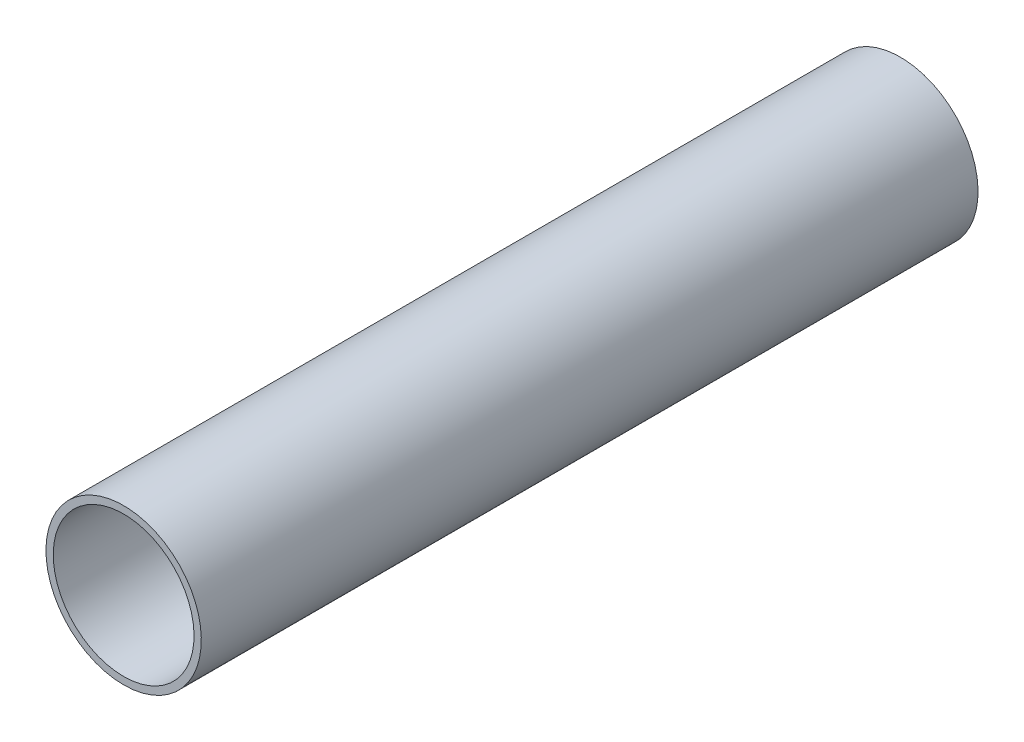
from build123d import *

# Parameters (mm, degrees)
SKETCH1_W = 80
SKETCH1_H = 0.75


with BuildPart() as part:
    # Sketch1 → Revolve1 (revolve)
    with BuildSketch(Plane(origin=(0, 0, 0), x_dir=(0, 0, -1), z_dir=(1, 0, 0)), mode=Mode.PRIVATE) as revolve1_sk:
        with Locations((0, 7.625)):
            Rectangle(SKETCH1_W, SKETCH1_H)
    revolve(revolve1_sk.sketch.rotate(Axis((0, 0, 40), (0, 0, -1)), 180), axis=Axis((0, 0, 40), (0, 0, -1)))


solid = part.part
